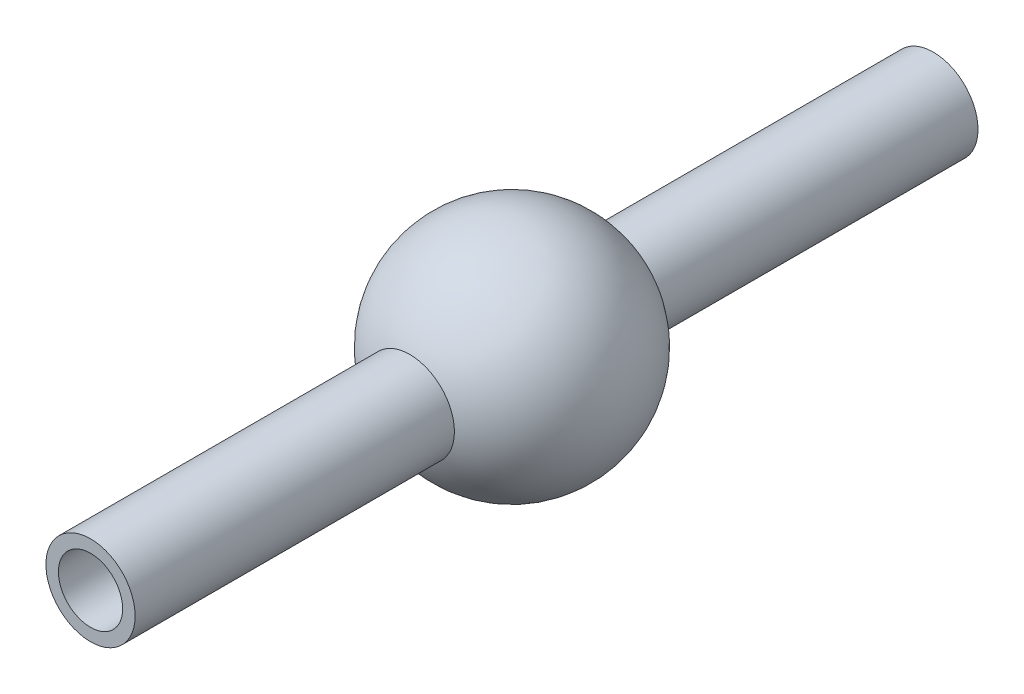
from build123d import *

# Parameters (mm, degrees)
CUT_EXTRUDE1_DEPTH       = 10
CUT_EXTRUDE1_DEPTH_BACK  = 10
SKETCH2_R                = 3.175
BOSS_EXTRUDE1_DEPTH      = 30
BOSS_EXTRUDE1_DEPTH_BACK = 30
SKETCH3_R                = 3.175
SKETCH3_R_2              = 2.286


with BuildPart() as part:
    # Sketch1 → Revolve1 (revolve)
    with BuildSketch(Plane(origin=(0, 0, 0), x_dir=(1, 0, 0), z_dir=(0, 1, 0))):
        with BuildLine():
            Line((0, 7.935), (0, -7.935))
            ThreePointArc((0, -7.935), (-7.935, 0), (0, 7.935))
        make_face()
    revolve(axis=Axis((0, 0, -16.813567773), (0, 0, 1)))

    # Sketch2 → Cut-Extrude1 (cut, two sides: drawn at the far end of the back side and taken through both)
    with BuildSketch(Plane.XY.offset(-CUT_EXTRUDE1_DEPTH_BACK)):
        Circle(SKETCH2_R)
    extrude(amount=CUT_EXTRUDE1_DEPTH + CUT_EXTRUDE1_DEPTH_BACK, mode=Mode.SUBTRACT)

    # Sketch3 → Boss-Extrude1 (add, two sides: drawn at the far end of the back side and taken through both)
    with BuildSketch(Plane.XY.offset(-BOSS_EXTRUDE1_DEPTH_BACK)):
        Circle(SKETCH3_R)
        Circle(SKETCH3_R_2, mode=Mode.SUBTRACT)
    extrude(amount=BOSS_EXTRUDE1_DEPTH + BOSS_EXTRUDE1_DEPTH_BACK)


solid = part.part
